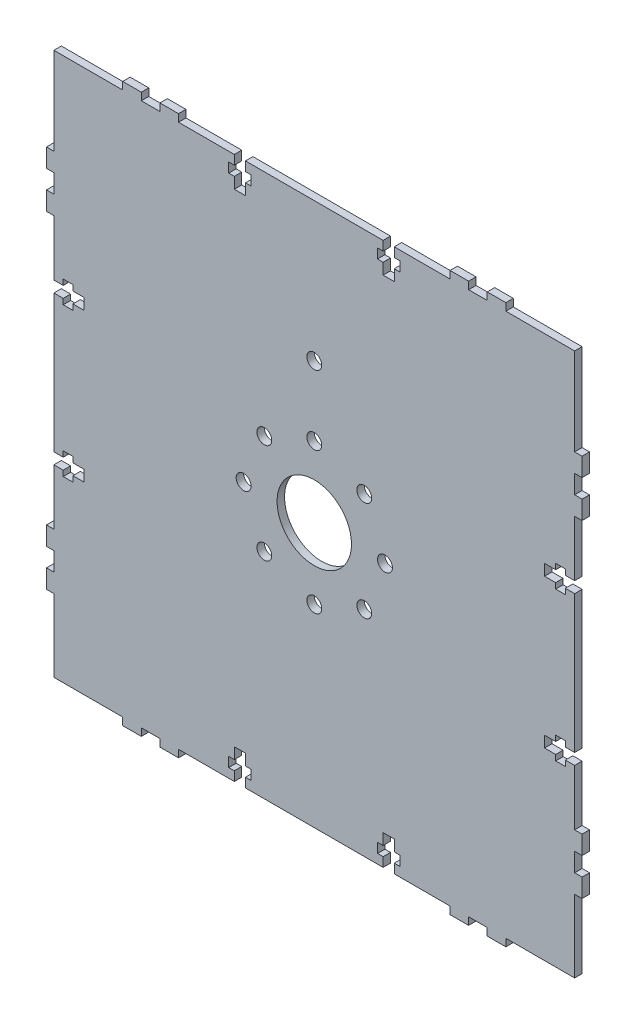
from build123d import *

# Parameters (mm, degrees)
SKETCH_1_R      = 10
SKETCH_1_R_2    = 2
EXTRUDE_1_DEPTH = 2


with BuildPart() as part:
    # 草图1 → 凸台-拉伸1 (new body)
    with BuildSketch(Plane.XY):
        Polygon((317.453360513, 257.462931603), (317.453360513, 258.962931602), (314.853360513, 258.962931602), (314.853360513, 257.462931603), (311.853360513, 257.462931603), (311.853360513, 254.462931603), (314.853360513, 254.462931603), (314.853360513, 252.962931603), (317.453360513, 252.962931603), (317.453360513, 254.462931603), (319.953360513, 254.462931603), (319.953360513, 239.462931603), (321.953360513, 239.462931603), (321.953360513, 234.462931603), (319.953360513, 234.462931603), (319.953360513, 229.462931603), (321.953360513, 229.462931603), (321.953360513, 224.462931603), (319.953360513, 224.462931603), (319.953360513, 219.462931603), (319.953360513, 204.962931603), (301.453360513, 204.962931603), (301.453360513, 202.962931603), (296.453360513, 202.962931603), (296.453360513, 204.962931603), (291.453360513, 204.962931603), (291.453360513, 202.962931603), (286.453360513, 202.962931603), (286.453360513, 204.962931603), (271.453360513, 204.962931603), (271.453360513, 207.462931603), (272.953360513, 207.462931603), (272.953360513, 210.062931603), (271.453360513, 210.062931603), (271.453360513, 213.062931603), (268.453360513, 213.062931603), (268.453360513, 210.062931603), (266.953360513, 210.062931603), (266.953360513, 207.462931603), (268.453360513, 207.462931603), (268.453360513, 204.962931603), (231.453360513, 204.962931603), (231.453360513, 207.462931603), (232.953360513, 207.462931603), (232.953360513, 210.062931603), (231.453360513, 210.062931603), (231.453360513, 213.062931603), (228.453360513, 213.062931603), (228.453360513, 210.062931603), (226.953360513, 210.062931603), (226.953360513, 207.462931603), (228.453360513, 207.462931603), (228.453360513, 204.962931603), (213.453360513, 204.962931603), (213.453360513, 202.962931603), (208.453360513, 202.962931603), (208.453360513, 204.962931603), (203.453360513, 204.962931603), (203.453360513, 202.962931603), (198.453360513, 202.962931603), (198.453360513, 204.962931603), (179.953360513, 204.962931603), (179.953360513, 219.462931603), (179.953360513, 224.462931603), (177.953360513, 224.462931603), (177.953360513, 229.462931603), (179.953360513, 229.462931603), (179.953360513, 234.462931603), (177.953360513, 234.462931603), (177.953360513, 239.462931603), (179.953360513, 239.462931603), (179.953360513, 254.462931603), (182.453360513, 254.462931603), (182.453360513, 252.962931603), (185.053360513, 252.962931603), (185.053360513, 254.462931603), (188.053360513, 254.462931603), (188.053360513, 257.462931603), (185.053360513, 257.462931603), (185.053360513, 258.962931602), (182.453360513, 258.962931602), (182.453360513, 257.462931603), (179.953360513, 257.462931603), (179.953360513, 294.462931603), (182.453360513, 294.462931603), (182.453360513, 292.962931603), (185.053360513, 292.962931603), (185.053360513, 294.462931603), (188.053360513, 294.462931603), (188.053360513, 297.462931603), (185.053360513, 297.462931603), (185.053360513, 298.962931603), (182.453360513, 298.962931603), (182.453360513, 297.462931603), (179.953360513, 297.462931603), (179.953360513, 312.462931602), (177.953360513, 312.462931602), (177.953360513, 317.462931602), (179.953360513, 317.462931602), (179.953360513, 322.462931603), (177.953360513, 322.462931603), (177.953360513, 327.462931603), (179.953360513, 327.462931603), (179.953360513, 332.462931603), (179.953360513, 350.962931603), (198.453360513, 350.962931603), (198.453360513, 352.962931603), (203.453360513, 352.962931603), (203.453360513, 350.962931603), (208.453360513, 350.962931603), (208.453360513, 352.962931603), (213.453360513, 352.962931603), (213.453360513, 350.962931603), (228.453360513, 350.962931603), (228.453360513, 348.462931603), (226.953360513, 348.462931603), (226.953360513, 345.862931603), (228.453360513, 345.862931603), (228.453360513, 342.862931603), (231.453360513, 342.862931603), (231.453360513, 345.862931603), (232.953360513, 345.862931603), (232.953360513, 348.462931603), (231.453360513, 348.462931603), (231.453360513, 350.962931603), (268.453360513, 350.962931603), (268.453360513, 348.462931603), (266.953360513, 348.462931603), (266.953360513, 345.862931603), (268.453360513, 345.862931603), (268.453360513, 342.862931603), (271.453360513, 342.862931603), (271.453360513, 345.862931603), (272.953360513, 345.862931603), (272.953360513, 348.462931603), (271.453360513, 348.462931603), (271.453360513, 350.962931603), (286.453360513, 350.962931603), (286.453360513, 352.962931603), (291.453360513, 352.962931603), (291.453360513, 350.962931603), (296.453360513, 350.962931603), (296.453360513, 352.962931603), (301.453360513, 352.962931603), (301.453360513, 350.962931603), (319.953360513, 350.962931603), (319.953360513, 332.462931603), (319.953360513, 327.462931603), (321.953360513, 327.462931603), (321.953360513, 322.462931603), (319.953360513, 322.462931603), (319.953360513, 317.462931602), (321.953360513, 317.462931602), (321.953360513, 312.462931602), (319.953360513, 312.462931602), (319.953360513, 297.462931603), (317.453360513, 297.462931603), (317.453360513, 298.962931603), (314.853360513, 298.962931603), (314.853360513, 297.462931603), (311.853360513, 297.462931603), (311.853360513, 294.462931603), (314.853360513, 294.462931603), (314.853360513, 292.962931603), (317.453360513, 292.962931603), (317.453360513, 294.462931603), (319.953360513, 294.462931603), (319.953360513, 257.462931603), align=None)
        with Locations((249.953360513, 275.962931603)):
            Circle(SKETCH_1_R, mode=Mode.SUBTRACT)
        with Locations((230.953360513, 275.962931603)):
            Circle(SKETCH_1_R_2, mode=Mode.SUBTRACT)
        with Locations((236.518331671, 289.397960445)):
            Circle(SKETCH_1_R_2, mode=Mode.SUBTRACT)
        with Locations((249.953360513, 294.962931603)):
            Circle(SKETCH_1_R_2, mode=Mode.SUBTRACT)
        with Locations((263.388389356, 289.397960445)):
            Circle(SKETCH_1_R_2, mode=Mode.SUBTRACT)
        with Locations((268.953360513, 275.962931603)):
            Circle(SKETCH_1_R_2, mode=Mode.SUBTRACT)
        with Locations((263.388389356, 262.52790276)):
            Circle(SKETCH_1_R_2, mode=Mode.SUBTRACT)
        with Locations((249.953360513, 256.962931603)):
            Circle(SKETCH_1_R_2, mode=Mode.SUBTRACT)
        with Locations((236.518331671, 262.52790276)):
            Circle(SKETCH_1_R_2, mode=Mode.SUBTRACT)
        with Locations((249.953360513, 313.636994259)):
            Circle(SKETCH_1_R_2, mode=Mode.SUBTRACT)
    extrude(amount=EXTRUDE_1_DEPTH)


solid = part.part
